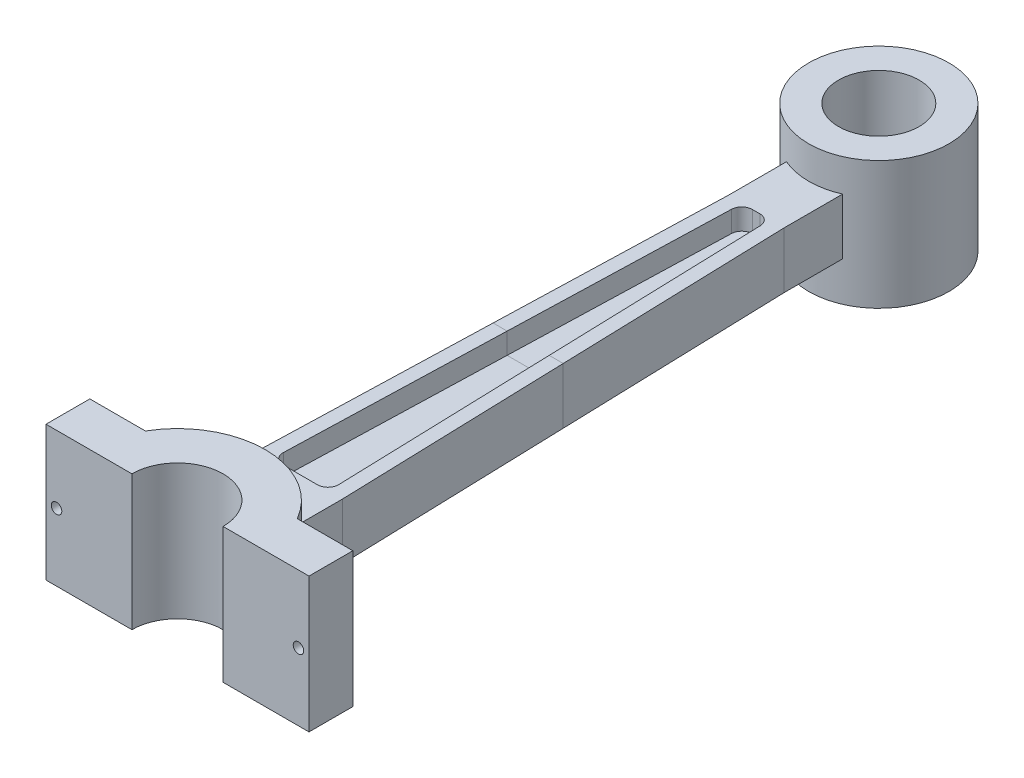
from build123d import *

# Parameters (mm, degrees)
BOSS_EXTRUDE1_DEPTH      = 34.5
BOSS_EXTRUDE1_DEPTH_BACK = 38.5
SKETCH1_R                = 40
SKETCH1_R_2              = 23
BOSS_EXTRUDE2_DEPTH      = 38.5
BOSS_EXTRUDE2_DEPTH_BACK = 38.5
BOSS_EXTRUDE4_REACH      = 337.98
BOSS_EXTRUDE4_END_RADIUS = 23
BOSS_EXTRUDE5_REACH      = 377.343
BOSS_EXTRUDE5_END_RADIUS = 26
SKETCH5_W                = 37
SKETCH5_H                = 77
SKETCH5_R                = 3
BOSS_EXTRUDE6_DEPTH      = 25
SKETCH6_W                = 22.629122871
SKETCH6_H                = 12
BOSS_EXTRUDE7_DEPTH      = 36
SKETCH7_W                = 30.808164115
SKETCH7_H                = 12
BOSS_EXTRUDE8_DEPTH      = 21
SKETCH8_W                = 30.808164115
SKETCH8_H                = 12
BOSS_EXTRUDE9_DEPTH      = 21
SKETCH10_W               = 26.136575601
SKETCH10_H               = 32
BOSS_EXTRUDE10_DEPTH     = 46
FILLET4_R                = 6
FILLET5_R                = 6


with BuildPart() as part:
    # Sketch1 → Boss-Extrude1 (new, two sides: drawn at the far end of the back side and taken through both)
    with BuildSketch(Plane(origin=(0, 0, 0), x_dir=(1, 0, 0), z_dir=(0, 1, 0)).offset(-BOSS_EXTRUDE1_DEPTH_BACK)):
        with Locations((0, 200)):
            Circle(SKETCH1_R)
        with Locations((0, 200)):
            Circle(SKETCH1_R_2, mode=Mode.SUBTRACT)
    extrude(amount=BOSS_EXTRUDE1_DEPTH + BOSS_EXTRUDE1_DEPTH_BACK)



with BuildPart() as body_2:
    # Sketch1<6> → Boss-Extrude2 (new, two sides: drawn at the far end of the back side and taken through both)
    with BuildSketch(Plane(origin=(0, 0, 0), x_dir=(1, 0, 0), z_dir=(0, 1, 0)).offset(-BOSS_EXTRUDE2_DEPTH_BACK)):
        with BuildLine():
            ThreePointArc((50, -200), (0, -150), (-50, -200))
            Line((-50, -200), (-26, -200))
            ThreePointArc((-26, -200), (0, -174), (26, -200))
            Line((26, -200), (50, -200))
        make_face()
    extrude(amount=BOSS_EXTRUDE2_DEPTH + BOSS_EXTRUDE2_DEPTH_BACK)



with BuildPart() as body_3:
    # Sketch3 → Loft1 section 0
    with BuildSketch(Plane.XY.offset(130)):
        with BuildLine():
            Line((-24, -16), (-24, 16))
            Line((-24, 16), (-16, 16))
            Line((-16, 16), (-16, 4))
            Line((-16, 4), (16, 4))
            Line((16, 4), (16, 16))
            Line((16, 16), (24, 16))
            Line((24, 16), (24, -16))
            Line((24, -16), (16, -16))
            Line((16, -16), (16, -4))
            Line((16, -4), (-16, -4))
            Line((-16, -4), (-16, -16))
            Line((-16, -16), (-24, -16))
        make_face()
    # Sketch4 → Loft1 section 1
    with BuildSketch(Plane.XY):
        with BuildLine():
            Line((-20, 16), (-12, 16))
            Line((-12, 16), (-12, 4))
            Line((-12, 4), (12, 4))
            Line((12, 4), (12, 16))
            Line((12, 16), (20, 16))
            Line((20, 16), (20, -16))
            Line((20, -16), (12, -16))
            Line((12, -16), (12, -4))
            Line((12, -4), (-12, -4))
            Line((-12, -4), (-12, -16))
            Line((-12, -16), (-20, -16))
            Line((-20, -16), (-20, 16))
        make_face()
    loft()


with BuildPart() as body_4:
    # Sketch4<3> → Loft3 section 0
    with BuildSketch(Plane.XY):
        with BuildLine():
            Line((-20, 16), (-12, 16))
            Line((-12, 16), (-12, 4))
            Line((-12, 4), (12, 4))
            Line((12, 4), (12, 16))
            Line((12, 16), (20, 16))
            Line((20, 16), (20, -16))
            Line((20, -16), (12, -16))
            Line((12, -16), (12, -4))
            Line((12, -4), (-12, -4))
            Line((-12, -4), (-12, -16))
            Line((-12, -16), (-20, -16))
            Line((-20, -16), (-20, 16))
        make_face()
    # Sketch2 → Loft3 section 1
    with BuildSketch(Plane.XY.offset(-130)):
        with BuildLine():
            Line((16, 16), (8, 16))
            Line((8, 16), (8, 4))
            Line((8, 4), (-8, 4))
            Line((-8, 4), (-8, 16))
            Line((-8, 16), (-16, 16))
            Line((-16, 16), (-16, -16))
            Line((-16, -16), (-8, -16))
            Line((-8, -16), (-8, -4))
            Line((-8, -4), (8, -4))
            Line((8, -4), (8, -16))
            Line((8, -16), (16, -16))
            Line((16, -16), (16, 16))
        make_face()
    loft()


with BuildPart() as part_1:
    add(part.part)

    add(body_4.part)  # Boss-Extrude4 merges body 4
    # Boss-Extrude4: up to this cylinder (the profile starts outside it)
    boss_extrude4_end = Plane(origin=(0, 0, -200), z_dir=(0, 1, 0)) * Cylinder(BOSS_EXTRUDE4_END_RADIUS, 722.96, mode=Mode.PRIVATE)
    # Sketch2<8> → Boss-Extrude4 (add, up to the surface)
    with BuildSketch(Plane.XY.offset(-130), mode=Mode.PRIVATE) as boss_extrude4_sk1:
        Polygon((16, 16), (8, 16), (8, 4), (-8, 4), (-8, 16), (-16, 16), (-16, -16), (-8, -16), (-8, -4), (8, -4), (8, -16), (16, -16), align=None)
    boss_extrude4_tool1 = extrude(boss_extrude4_sk1.sketch, amount=-BOSS_EXTRUDE4_REACH, mode=Mode.PRIVATE) - boss_extrude4_end
    add(boss_extrude4_tool1.solids().sort_by_distance((0, 0, -130))[0])

    # Sketch7 → Boss-Extrude8 (add)
    with BuildSketch(Plane.ZY.offset(-8)):
        with Locations((-145.404082058, -10)):
            Rectangle(SKETCH7_W, SKETCH7_H)
    extrude(amount=BOSS_EXTRUDE8_DEPTH)

    # Sketch8 → Boss-Extrude9 (add)
    with BuildSketch(Plane.ZY.offset(-8)):
        with Locations((-145.404082058, 10)):
            Rectangle(SKETCH8_W, SKETCH8_H)
    extrude(amount=BOSS_EXTRUDE9_DEPTH)

    # Fillet4
    fillet4_edges = [part_1.edges().sort_by_distance(p)[0] for p in [
        (8, 10, -130),
        (-8, 10, -130),
        (-8, -10, -130),
        (8, -10, -130),
    ]]
    fillet(fillet4_edges, radius=FILLET4_R)


with BuildPart() as body_2_1:
    add(body_2.part)

    add(body_3.part)  # Boss-Extrude5 merges body 3
    # Boss-Extrude5: up to this cylinder (the profile starts outside it)
    boss_extrude5_end = Plane(origin=(0, 0, 200), z_dir=(0, 1, 0)) * Cylinder(BOSS_EXTRUDE5_END_RADIUS, 807.686, mode=Mode.PRIVATE)
    # Sketch3<3> → Boss-Extrude5 (add, up to the surface)
    with BuildSketch(Plane.XY.offset(130), mode=Mode.PRIVATE) as boss_extrude5_sk1:
        Polygon((-24, -16), (-24, 16), (-16, 16), (-16, 4), (16, 4), (16, 16), (24, 16), (24, -16), (16, -16), (16, -4), (-16, -4), (-16, -16), align=None)
    boss_extrude5_tool1 = extrude(boss_extrude5_sk1.sketch, amount=BOSS_EXTRUDE5_REACH, mode=Mode.PRIVATE) - boss_extrude5_end
    add(boss_extrude5_tool1.solids().sort_by_distance((0, 0, 130))[0])

    # Sketch5 → Boss-Extrude6 (add)
    # profile 1 of 2: a face of its own
    with BuildSketch(Plane.XY.offset(200)):
        with Locations((56.5, 0)):
            Rectangle(SKETCH5_W, SKETCH5_H)
        with Locations((69, 0)):
            Circle(SKETCH5_R, mode=Mode.SUBTRACT)
    # profile 2 of 2: a face of its own
    with BuildSketch(Plane.XY.offset(200)):
        with Locations((-56.5, 0)):
            Rectangle(SKETCH5_W, SKETCH5_H)
        with Locations((-69, 0)):
            Circle(SKETCH5_R, mode=Mode.SUBTRACT)
    extrude(amount=-BOSS_EXTRUDE6_DEPTH)

    # Sketch6 → Boss-Extrude7 (add)
    with BuildSketch(Plane(origin=(-16, 0, 0), x_dir=(0, 0, -1), z_dir=(1, 0, 0))):
        with Locations((-141.314561436, 10)):
            Rectangle(SKETCH6_W, SKETCH6_H)
    extrude(amount=BOSS_EXTRUDE7_DEPTH)

    # Sketch10 → Boss-Extrude10 (add)
    with BuildSketch(Plane.ZY.offset(24)):
        with Locations((143.068287801, 0)):
            Rectangle(SKETCH10_W, SKETCH10_H)
    extrude(amount=-BOSS_EXTRUDE10_DEPTH)

    # Fillet5
    fillet5_edges = [body_2_1.edges().sort_by_distance(p)[0] for p in [
        (-16, -10, 130),
        (16, -10, 130),
        (-16, 10, 130),
        (16, 10, 130),
    ]]
    fillet(fillet5_edges, radius=FILLET5_R)


solid = Compound([part_1.part, body_2_1.part])
